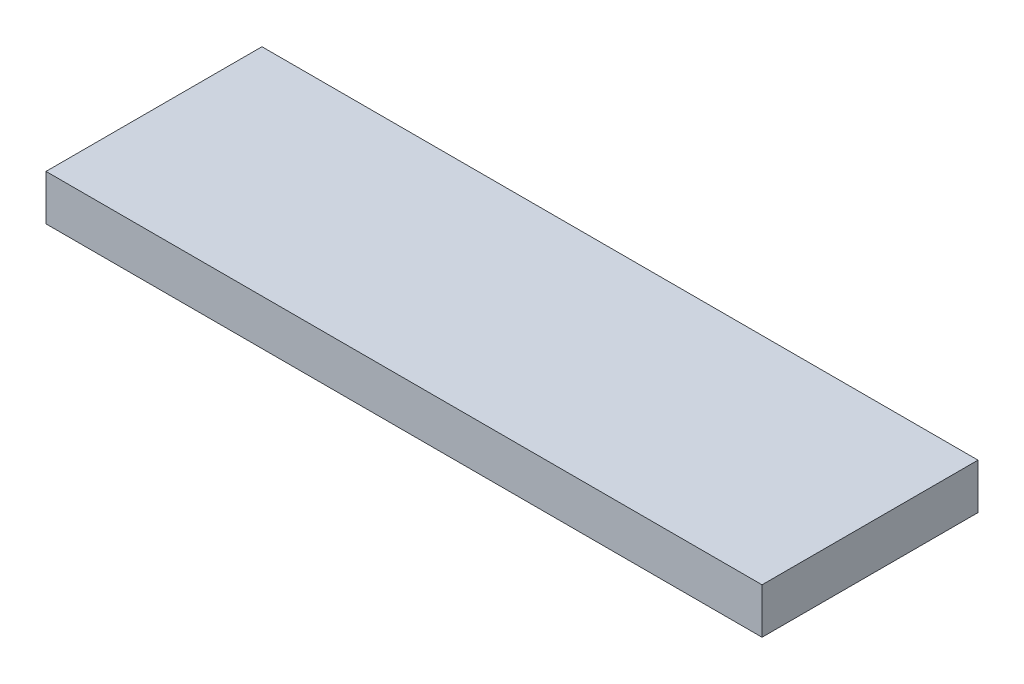
from build123d import *

# Parameters (mm, degrees)
SKETCH1_W           = 63
SKETCH1_H           = 19
BOSS_EXTRUDE1_DEPTH = 4


with BuildPart() as part:
    # Sketch1 → Boss-Extrude1 (new body)
    with BuildSketch(Plane(origin=(0, 0, 0), x_dir=(1, 0, 0), z_dir=(0, 1, 0))):
        Rectangle(SKETCH1_W, SKETCH1_H)
    extrude(amount=BOSS_EXTRUDE1_DEPTH)


solid = part.part
